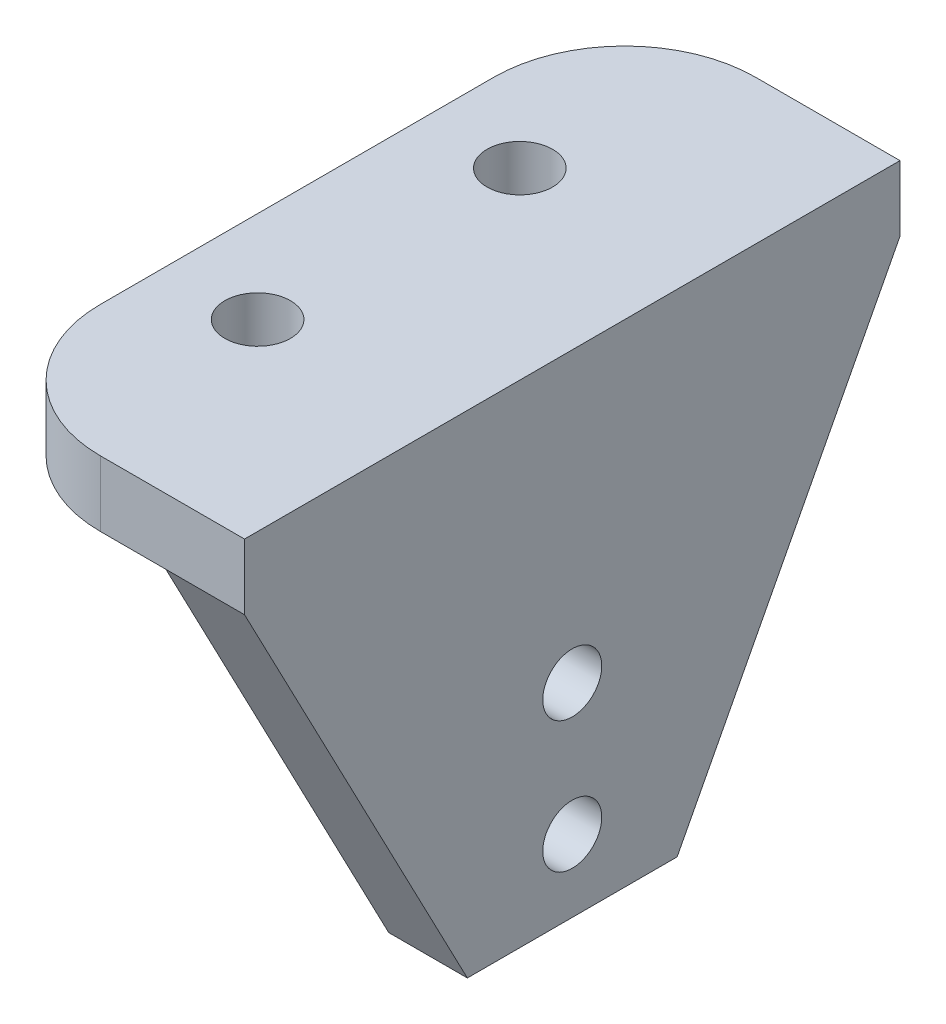
from build123d import *

# Parameters (mm, degrees)
ESBO_O1_W                                    = 15
ESBO_O1_H                                    = 50
RESSALTO_EXTRUS_O1_DEPTH                     = 5
ESBO_O2_R                                    = 2.5
CORTE_EXTRUS_O1_DEPTH                        = 53.440442409
FILETE1_R                                    = 10
RESSALTO_EXTRUS_O2_DEPTH                     = 6
REBAIXO_PARA_PARAFUSO_COM_CABE_A_RED_2_COUNT = 2
REBAIXO_PARA_PARAFUSO_COM_CABE_A_RED_2_PITCH = 10


with BuildPart() as part:
    # Esboço1 → Ressalto-extrusão1 (new body)
    with BuildSketch(Plane(origin=(0, 0, 0), x_dir=(1, 0, 0), z_dir=(0, 1, 0))):
        with Locations((7.5, 25)):
            Rectangle(ESBO_O1_W, ESBO_O1_H)
    extrude(amount=RESSALTO_EXTRUS_O1_DEPTH)

    # Esboço2 → Corte-extrusão1 (cut, through all)
    with BuildSketch(Plane(origin=(0, 5, 0), x_dir=(1, 0, 0), z_dir=(0, 1, 0))):
        with Locations(Location((7, 35, 0), (0, 0, 270))):
            Circle(ESBO_O2_R)
        with Locations(Location((7, 15, 0), (0, 0, 270))):
            Circle(ESBO_O2_R)
    extrude(amount=-CORTE_EXTRUS_O1_DEPTH, mode=Mode.SUBTRACT)

    # Filete1
    filete1_edges = [part.edges().sort_by_distance(p)[0] for p in [
        (0, 2.5, -50),
        (0, 2.5, 0),
    ]]
    fillet(filete1_edges, radius=FILETE1_R)

    # Esboço3 → Ressalto-extrusão2 (add)
    with BuildSketch(Plane(origin=(15, 0, 0), x_dir=(0, 0, -1), z_dir=(1, 0, 0))):
        Polygon((50, 5), (0, 5), (0, 0), (17, -32.5), (33, -32.5), (50, 0), align=None)
    extrude(amount=RESSALTO_EXTRUS_O2_DEPTH)

    # Esboço6 → Rebaixo para parafuso com cabeça redonda de M41 (revolve, cut)
    with BuildSketch(Plane(origin=(15, -27, -25), x_dir=(0, 0, 1), z_dir=(0, 1, 0))):
        Polygon((0, 0), (0, 6), (2.25, 6), (2.25, 2.6), (4, 2.6), (4, 0.025), (4.025, 0), align=None)
    rebaixo_para_parafuso_com_cabe_a_redonda = revolve(axis=Axis((8.65, -27, -25), (1, 0, 0)), mode=Mode.SUBTRACT)

    # Rebaixo para parafuso com cabe_a red 2: Rebaixo para parafuso com cabeça redonda de M41 ×2
    with Locations(*[(0, i * REBAIXO_PARA_PARAFUSO_COM_CABE_A_RED_2_PITCH, 0) for i in range(1, REBAIXO_PARA_PARAFUSO_COM_CABE_A_RED_2_COUNT)]):
        add(rebaixo_para_parafuso_com_cabe_a_redonda, mode=Mode.SUBTRACT)


solid = part.part
